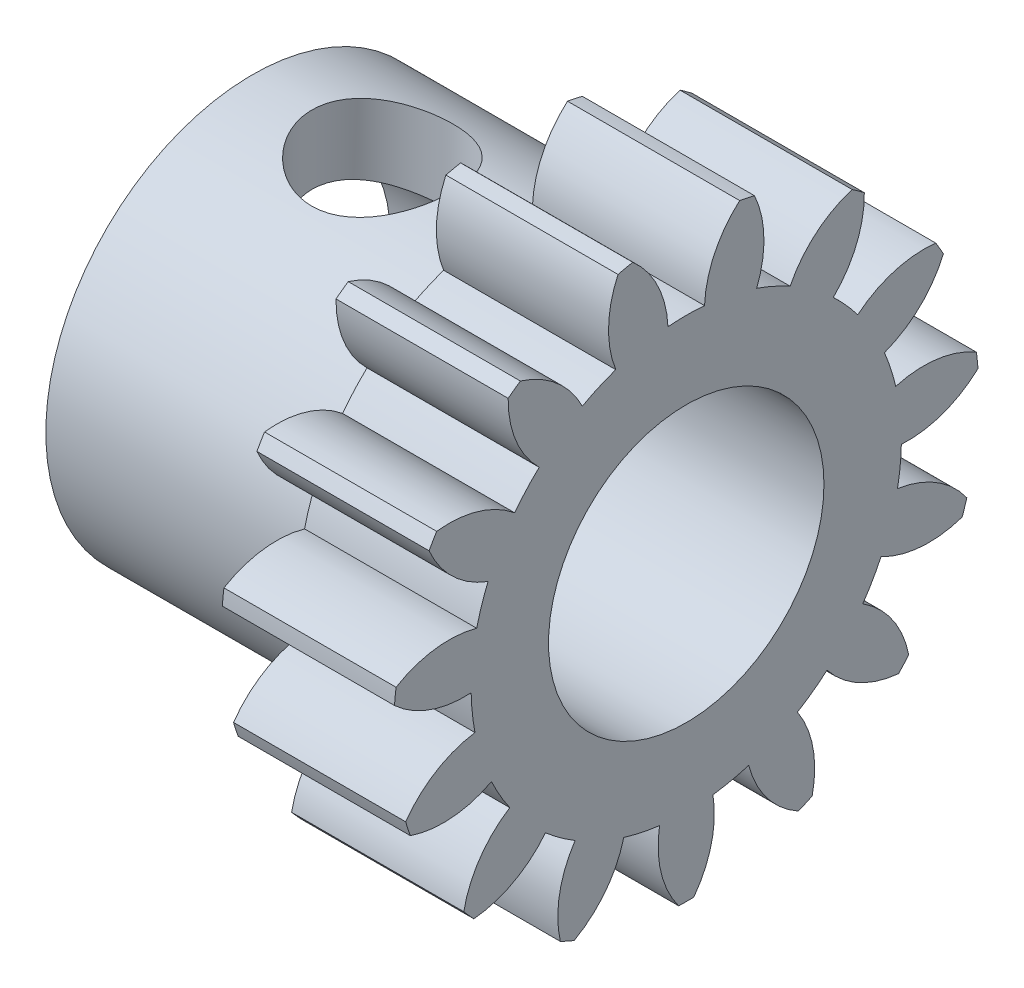
from build123d import *

# Parameters (mm, degrees)
SKETCH1_W                      = 2.5
SKETCH1_H                      = 4.25
CUT_EXTRUDE1_DEPTH             = 7.509608283
CUT_EXTRUDE2_DEPTH             = 7.509608283
CUT_EXTRUDE3_DEPTH             = 7.509608283
CUT_EXTRUDE4_DEPTH             = 7.509608283
CUT_EXTRUDE5_DEPTH             = 7.509608283
CUT_EXTRUDE6_DEPTH             = 7.509608283
CUT_EXTRUDE7_DEPTH             = 7.509608283
CUT_EXTRUDE8_DEPTH             = 7.509608283
CUT_EXTRUDE9_DEPTH             = 7.509608283
CUT_EXTRUDE10_DEPTH            = 7.509608283
CUT_EXTRUDE11_DEPTH            = 7.500982013
CUT_EXTRUDE12_DEPTH            = 7.500982013
CUT_EXTRUDE13_DEPTH            = 7.500982013
CUT_EXTRUDE14_DEPTH            = 7.500982013
CUT_EXTRUDE15_DEPTH            = 7.500982013
SKETCH17_W                     = 3.8000508
SKETCH17_H                     = 3
F_4_0_4_DIAMETER_HOLE1_D       = 4
TAP_DRILL_FOR_M2_5X0_45_TAP1_D = 2.05


with BuildPart() as part:
    # Sketch1 → Revolve1 (revolve)
    with BuildSketch(Plane(origin=(0, 0, 0), x_dir=(-1, 0, 0), z_dir=(0, 0, -1)), mode=Mode.PRIVATE) as revolve1_sk:
        with Locations((-1.25, 2.125)):
            Rectangle(SKETCH1_W, SKETCH1_H)
    revolve(revolve1_sk.sketch.rotate(Axis((2.5, 0, 0), (-1, 0, 0)), 270), axis=Axis((2.5, 0, 0), (-1, 0, 0)))

    # Sketch2 → Cut-Extrude1 (cut, through all)
    with BuildSketch(Plane(origin=(2.5, 0, 0), x_dir=(0, 0, -1), z_dir=(1, 0, 0))):
        with BuildLine():
            ThreePointArc((2.585993953, 3.372704445), (2.472774023, 2.780247912), (2.135335156, 2.280289405))
            ThreePointArc((2.135335156, 2.280289405), (2.321584435, 2.090364014), (2.491001044, 1.88528242))
            ThreePointArc((2.491001044, 1.88528242), (3.023492692, 2.168612866), (3.624538392, 2.219283994))
            ThreePointArc((3.624538392, 2.219283994), (3.158365508, 2.843805077), (2.585993953, 3.372704445))
        make_face()
    extrude(amount=-CUT_EXTRUDE1_DEPTH, mode=Mode.SUBTRACT)

    # Sketch3 → Cut-Extrude2 (cut, through all)
    with BuildSketch(Plane(origin=(2.5, 0, 0), x_dir=(0, 0, -1), z_dir=(1, 0, 0))):
        with BuildLine():
            ThreePointArc((3.734225512, 2.029300328), (3.389820178, 1.534115047), (2.87820299, 1.214628975))
            ThreePointArc((2.87820299, 1.214628975), (2.971100557, 0.96536909), (3.042456131, 0.709109787))
            ThreePointArc((3.042456131, 0.709109787), (3.644152332, 0.751361165), (4.213844705, 0.553184234))
            ThreePointArc((4.213844705, 0.553184234), (4.041990194, 1.313322226), (3.734225512, 2.029300328))
        make_face()
    extrude(amount=-CUT_EXTRUDE2_DEPTH, mode=Mode.SUBTRACT)

    # Sketch4 → Cut-Extrude3 (cut, through all)
    with BuildSketch(Plane(origin=(2.5, 0, 0), x_dir=(0, 0, -1), z_dir=(1, 0, 0))):
        with BuildLine():
            ThreePointArc((4.236775558, 0.335011746), (3.72073563, 0.022719752), (3.12340338, -0.061051839))
            ThreePointArc((3.12340338, -0.061051839), (3.106886401, -0.326546919), (3.067842913, -0.589674367))
            ThreePointArc((3.067842913, -0.589674367), (3.634704928, -0.795807707), (4.074538988, -1.208566106))
            ThreePointArc((4.074538988, -1.208566106), (4.226718055, -0.444245969), (4.236775558, 0.335011746))
        make_face()
    extrude(amount=-CUT_EXTRUDE3_DEPTH, mode=Mode.SUBTRACT)

    # Sketch5 → Cut-Extrude4 (cut, through all)
    with BuildSketch(Plane(origin=(2.5, 0, 0), x_dir=(0, 0, -1), z_dir=(1, 0, 0))):
        with BuildLine():
            ThreePointArc((4.00674862, -1.417203408), (3.40830209, -1.492603993), (2.82853895, -1.326176235))
            ThreePointArc((2.82853895, -1.326176235), (2.705463361, -1.562), (2.562771785, -1.786498468))
            ThreePointArc((2.562771785, -1.786498468), (2.996784021, -2.205374197), (3.230708464, -2.761344386))
            ThreePointArc((3.230708464, -2.761344386), (3.680607966, -2.124999999), (4.00674862, -1.417203408))
        make_face()
    extrude(amount=-CUT_EXTRUDE4_DEPTH, mode=Mode.SUBTRACT)

    # Sketch6 → Cut-Extrude5 (cut, through all)
    with BuildSketch(Plane(origin=(2.5, 0, 0), x_dir=(0, 0, -1), z_dir=(1, 0, 0))):
        with BuildLine():
            ThreePointArc((3.083918444, -2.92437122), (2.506542154, -2.749842949), (2.044594439, -2.361992714))
            ThreePointArc((2.044594439, -2.361992714), (1.836241128, -2.52736909), (1.614574134, -2.674420753))
            ThreePointArc((1.614574134, -2.674420753), (1.840691933, -3.233611452), (1.828259097, -3.836661137))
            ThreePointArc((1.828259097, -3.836661137), (2.498087322, -3.438322226), (3.083918444, -2.92437122))
        make_face()
    extrude(amount=-CUT_EXTRUDE5_DEPTH, mode=Mode.SUBTRACT)

    # Sketch7 → Cut-Extrude6 (cut, through all)
    with BuildSketch(Plane(origin=(2.5, 0, 0), x_dir=(0, 0, -1), z_dir=(1, 0, 0))):
        with BuildLine():
            ThreePointArc((1.627850754, -3.925888679), (1.17137831, -3.531609077), (0.907120976, -2.989399193))
            ThreePointArc((0.907120976, -2.989399193), (0.649516122, -3.055733105), (0.387201946, -3.099911394))
            ThreePointArc((0.387201946, -3.099911394), (0.366327487, -3.702727912), (0.109687121, -4.248584321))
            ThreePointArc((0.109687121, -4.248584321), (0.883624686, -4.157127303), (1.627850754, -3.925888679))
        make_face()
    extrude(amount=-CUT_EXTRUDE6_DEPTH, mode=Mode.SUBTRACT)

    # Sketch8 → Cut-Extrude7 (cut, through all)
    with BuildSketch(Plane(origin=(2.5, 0, 0), x_dir=(0, 0, -1), z_dir=(1, 0, 0))):
        with BuildLine():
            ThreePointArc((-0.109687122, -4.248584322), (-0.366327487, -3.702727912), (-0.387201947, -3.099911394))
            ThreePointArc((-0.387201947, -3.099911394), (-0.649516122, -3.055733105), (-0.907120975, -2.989399193))
            ThreePointArc((-0.907120975, -2.989399193), (-1.171378309, -3.531609077), (-1.627850753, -3.92588868))
            ThreePointArc((-1.627850753, -3.92588868), (-0.883624686, -4.157127304), (-0.109687122, -4.248584322))
        make_face()
    extrude(amount=-CUT_EXTRUDE7_DEPTH, mode=Mode.SUBTRACT)

    # Sketch9 → Cut-Extrude8 (cut, through all)
    with BuildSketch(Plane(origin=(2.5, 0, 0), x_dir=(0, 0, -1), z_dir=(1, 0, 0))):
        with BuildLine():
            ThreePointArc((-1.828259096, -3.836661137), (-1.840691932, -3.233611453), (-1.614574133, -2.674420754))
            ThreePointArc((-1.614574133, -2.674420754), (-1.836241128, -2.527369091), (-2.044594439, -2.361992714))
            ThreePointArc((-2.044594439, -2.361992714), (-2.506542155, -2.749842949), (-3.083918444, -2.92437122))
            ThreePointArc((-3.083918444, -2.92437122), (-2.498087322, -3.438322226), (-1.828259096, -3.836661137))
        make_face()
    extrude(amount=-CUT_EXTRUDE8_DEPTH, mode=Mode.SUBTRACT)

    # Sketch10 → Cut-Extrude9 (cut, through all)
    with BuildSketch(Plane(origin=(2.5, 0, 0), x_dir=(0, 0, -1), z_dir=(1, 0, 0))):
        with BuildLine():
            ThreePointArc((-3.230708464, -2.761344387), (-2.996784021, -2.205374197), (-2.562771785, -1.786498468))
            ThreePointArc((-2.562771785, -1.786498468), (-2.705463361, -1.562), (-2.82853895, -1.326176236))
            ThreePointArc((-2.82853895, -1.326176236), (-3.40830209, -1.492603994), (-4.006748619, -1.417203409))
            ThreePointArc((-4.006748619, -1.417203409), (-3.680607966, -2.125), (-3.230708464, -2.761344387))
        make_face()
    extrude(amount=-CUT_EXTRUDE9_DEPTH, mode=Mode.SUBTRACT)

    # Sketch11 → Cut-Extrude10 (cut, through all)
    with BuildSketch(Plane(origin=(2.5, 0, 0), x_dir=(0, 0, -1), z_dir=(1, 0, 0))):
        with BuildLine():
            ThreePointArc((-4.074538989, -1.208566105), (-3.634704928, -0.795807707), (-3.067842914, -0.589674368))
            ThreePointArc((-3.067842914, -0.589674368), (-3.106886402, -0.326546919), (-3.12340338, -0.061051839))
            ThreePointArc((-3.12340338, -0.061051839), (-3.720735631, 0.022719752), (-4.236775558, 0.335011747))
            ThreePointArc((-4.236775558, 0.335011747), (-4.226718056, -0.444245968), (-4.074538989, -1.208566105))
        make_face()
    extrude(amount=-CUT_EXTRUDE10_DEPTH, mode=Mode.SUBTRACT)

    # Sketch12 → Cut-Extrude11 (cut, through all)
    with BuildSketch(Plane(origin=(2.5, 0, 0), x_dir=(0, 0, -1), z_dir=(1, 0, 0))):
        with BuildLine():
            ThreePointArc((-4.213844706, 0.553184234), (-3.644152332, 0.751361165), (-3.042456131, 0.709109788))
            ThreePointArc((-3.042456131, 0.709109788), (-2.971100557, 0.96536909), (-2.87820299, 1.214628975))
            ThreePointArc((-2.87820299, 1.214628975), (-3.389820179, 1.534115046), (-3.734225513, 2.029300326))
            ThreePointArc((-3.734225513, 2.029300326), (-4.041990195, 1.313322226), (-4.213844706, 0.553184234))
        make_face()
    extrude(amount=-CUT_EXTRUDE11_DEPTH, mode=Mode.SUBTRACT)

    # Sketch13 → Cut-Extrude12 (cut, through all)
    with BuildSketch(Plane(origin=(2.5, 0, 0), x_dir=(0, 0, -1), z_dir=(1, 0, 0))):
        with BuildLine():
            ThreePointArc((-2.585993952, 3.372704446), (-3.158365508, 2.843805077), (-3.624538391, 2.219283994))
            ThreePointArc((-3.624538391, 2.219283994), (-3.023492692, 2.168612865), (-2.491001044, 1.885282419))
            ThreePointArc((-2.491001044, 1.885282419), (-2.321584435, 2.090364014), (-2.135335156, 2.280289405))
            ThreePointArc((-2.135335156, 2.280289405), (-2.472774022, 2.780247912), (-2.585993952, 3.372704446))
        make_face()
    extrude(amount=-CUT_EXTRUDE12_DEPTH, mode=Mode.SUBTRACT)

    # Sketch14 → Cut-Extrude13 (cut, through all)
    with BuildSketch(Plane(origin=(2.5, 0, 0), x_dir=(0, 0, -1), z_dir=(1, 0, 0))):
        with BuildLine():
            ThreePointArc((-0.990620545, 4.132937326), (-1.728630733, 3.882568195), (-2.408516462, 3.501649391))
            ThreePointArc((-2.408516462, 3.501649391), (-1.880043697, 3.210891701), (-1.508829246, 2.735472593))
            ThreePointArc((-1.508829246, 2.735472593), (-1.270645273, 2.85391601), (-1.023248474, 2.951667081))
            ThreePointArc((-1.023248474, 2.951667081), (-1.128162774, 3.545650656), (-0.990620545, 4.132937326))
        make_face()
    extrude(amount=-CUT_EXTRUDE13_DEPTH, mode=Mode.SUBTRACT)

    # Sketch15 → Cut-Extrude14 (cut, through all)
    with BuildSketch(Plane(origin=(2.5, 0, 0), x_dir=(0, 0, -1), z_dir=(1, 0, 0))):
        with BuildLine():
            ThreePointArc((-0.776040155, 4.178547795), (-0.411518069, 3.69797819), (-0.265767165, 3.112674704))
            ThreePointArc((-0.265767165, 3.112674704), (0, 3.124), (0.265767165, 3.112674704))
            ThreePointArc((0.265767165, 3.112674704), (0.411518069, 3.69797819), (0.776040156, 4.178547795))
            ThreePointArc((0.776040156, 4.178547795), (0, 4.25), (-0.776040155, 4.178547795))
        make_face()
    extrude(amount=-CUT_EXTRUDE14_DEPTH, mode=Mode.SUBTRACT)

    # Sketch16 → Cut-Extrude15 (cut, through all)
    with BuildSketch(Plane(origin=(2.5, 0, 0), x_dir=(0, 0, -1), z_dir=(1, 0, 0))):
        with BuildLine():
            ThreePointArc((0.990620545, 4.132937326), (1.128162774, 3.545650656), (1.023248474, 2.951667081))
            ThreePointArc((1.023248474, 2.951667081), (1.270645273, 2.85391601), (1.508829246, 2.735472593))
            ThreePointArc((1.508829246, 2.735472593), (1.880043697, 3.210891701), (2.408516462, 3.50164939))
            ThreePointArc((2.408516462, 3.50164939), (1.728630733, 3.882568195), (0.990620545, 4.132937326))
        make_face()
    extrude(amount=-CUT_EXTRUDE15_DEPTH, mode=Mode.SUBTRACT)

    # Sketch17 → Revolve2 (revolve)
    with BuildSketch(Plane.XY, mode=Mode.PRIVATE) as revolve2_sk:
        with Locations((-1.9000254, 1.5)):
            Rectangle(SKETCH17_W, SKETCH17_H)
    revolve(revolve2_sk.sketch.rotate(Axis((-3.8000508, 0, 0), (1, 0, 0)), 270), axis=Axis((-3.8000508, 0, 0), (1, 0, 0)))

    # Ø4.0 (4) Diameter Hole1 (through all)
    with Locations(Plane(origin=(2.5, 0, 0), x_dir=(0, 0, -1), z_dir=(1, 0, 0))):
        with Locations((0, 0)):
            Hole(F_4_0_4_DIAMETER_HOLE1_D / 2)

    # Tap Drill for M2.5x0.45 Tap1 (through all)
    with Locations(Plane(origin=(-1.9000508, 2.999970615, 0.013278053), x_dir=(0, -0.004426017667, 0.999990205136), z_dir=(0, 0.999990205136, 0.004426017667))):
        with Locations((0, 0)):
            Hole(TAP_DRILL_FOR_M2_5X0_45_TAP1_D / 2)


solid = part.part
